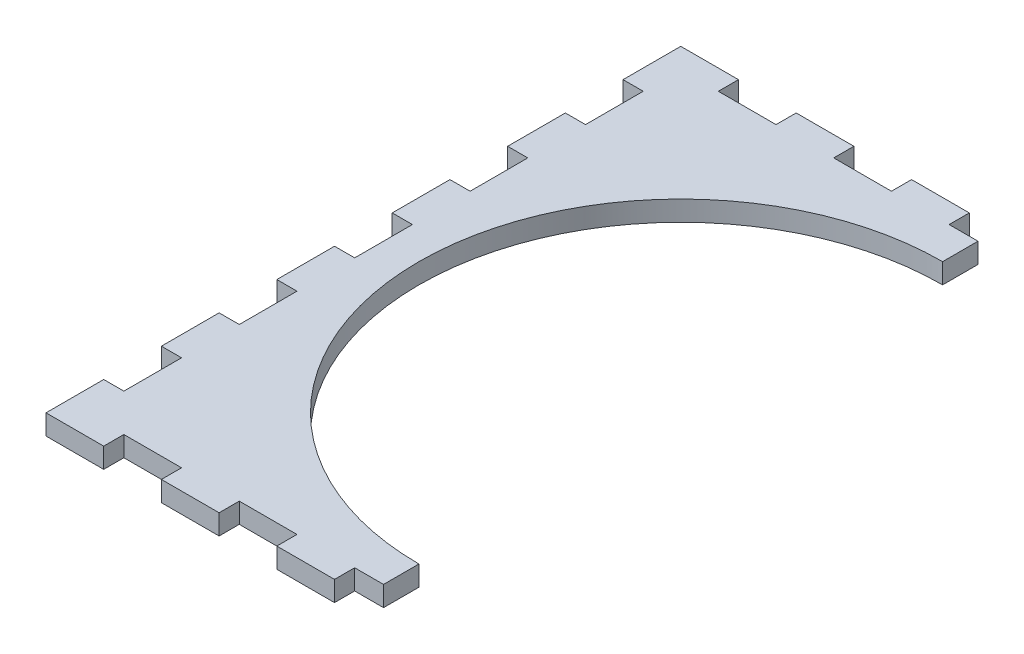
from build123d import *

# Parameters (mm, degrees)
BOSS_EXTRU_1_DEPTH      = 6.35
ESQUISSE2_W             = 18.18
ESQUISSE2_H             = 6.35
ESQUISSE2_W_2           = 6.35
ESQUISSE2_H_2           = 18.181818182
ESQUISSE2_W_3           = 18.181818182
ENL_V_MAT_EXTRU_1_DEPTH = 6.35


with BuildPart() as part:
    # Esquisse1 → Boss.-Extru.1 (new body)
    with BuildSketch(Plane(origin=(0, 0, 0), x_dir=(1, 0, 0), z_dir=(0, 1, 0))):
        with BuildLine():
            Line((0, -82.5), (0, -100))
            Line((0, -100), (-100, -100))
            Line((-100, -100), (-100, 100))
            Line((-100, 100), (0, 100))
            Line((0, 100), (0, 82.5))
            ThreePointArc((0, 82.5), (-82.5, 0), (0, -82.5))
        make_face()
    extrude(amount=BOSS_EXTRU_1_DEPTH)

    # Esquisse2 → Enlèv. mat.-Extru.1 (cut)
    with BuildSketch(Plane(origin=(0, 6.35, 0), x_dir=(1, 0, 0), z_dir=(0, 1, 0))):
        with Locations((-72.73, -96.825)):
            Rectangle(ESQUISSE2_W, ESQUISSE2_H)
        with Locations((-36.37, -96.825)):
            Rectangle(ESQUISSE2_W, ESQUISSE2_H)
        with Locations((-0.01, -96.825)):
            Rectangle(ESQUISSE2_W, ESQUISSE2_H)
        with Locations((-96.825, -72.727272727)):
            Rectangle(ESQUISSE2_W_2, ESQUISSE2_H_2)
        with Locations((-96.825, -36.363636364)):
            Rectangle(ESQUISSE2_W_2, ESQUISSE2_H_2)
        with Locations((-96.825, 0)):
            Rectangle(ESQUISSE2_W_2, ESQUISSE2_H_2)
        with Locations((-96.825, 36.363636364)):
            Rectangle(ESQUISSE2_W_2, ESQUISSE2_H_2)
        with Locations((-96.825, 72.727272727)):
            Rectangle(ESQUISSE2_W_2, ESQUISSE2_H_2)
        with Locations((-72.727272727, 96.825)):
            Rectangle(ESQUISSE2_W_3, ESQUISSE2_H)
        with Locations((-36.363636364, 96.825)):
            Rectangle(ESQUISSE2_W_3, ESQUISSE2_H)
        with Locations((-0.000909091, 96.825)):
            Rectangle(ESQUISSE2_W, ESQUISSE2_H)
    extrude(amount=-ENL_V_MAT_EXTRU_1_DEPTH, mode=Mode.SUBTRACT)


solid = part.part
